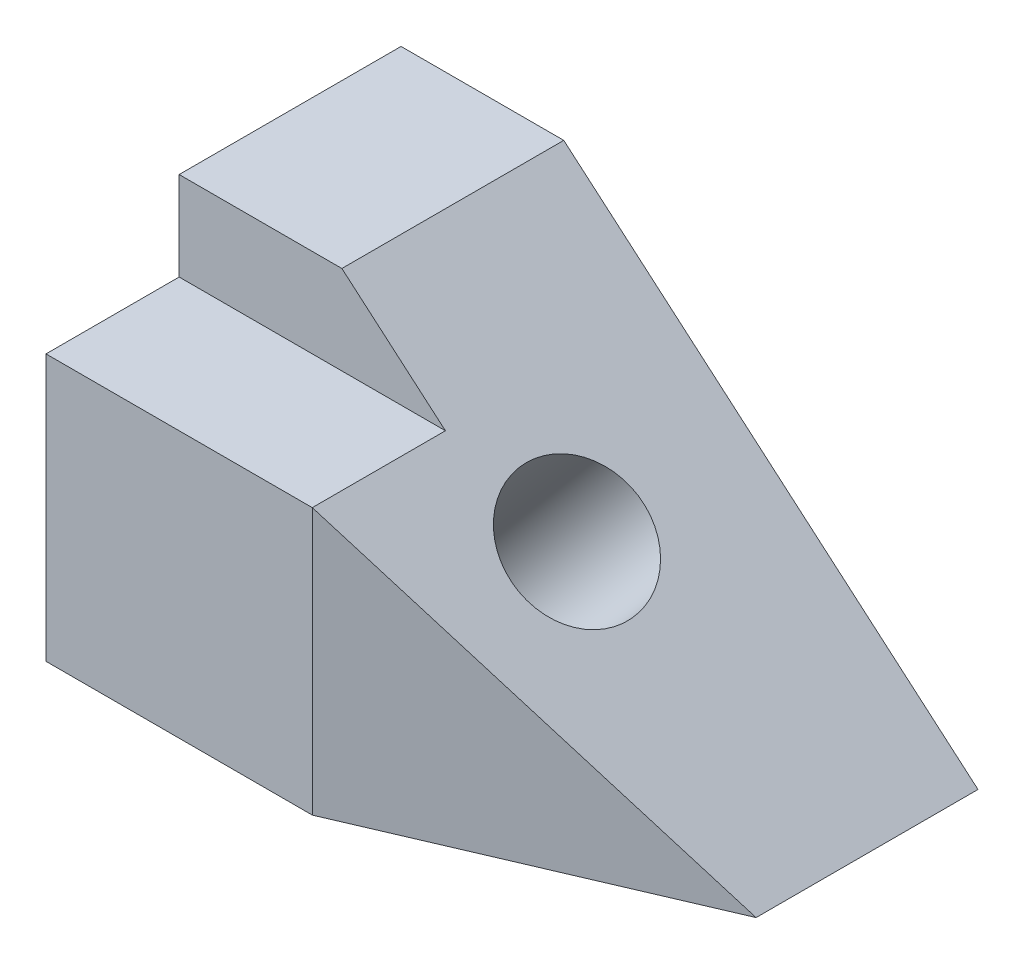
from build123d import *

# Parameters (mm, degrees)
BOSS_EXTRUDE1_DEPTH = 50
BOSS_EXTRUDE2_DEPTH = 30
SKETCH3_R           = 15
CUT_EXTRUDE1_DEPTH  = 30
CUT_EXTRUDE3_REACH  = 103.85
CUT_EXTRUDE4_REACH  = 132.508
SKETCH3_3_R         = 15


with BuildPart() as part:
    # Sketch1 → Boss-Extrude1 (new body)
    with BuildSketch(Plane.XY):
        Polygon((-27.961904762, 106.171428571), (-64.628571429, 106.171428571), (-64.628571429, 26.171428571), (65.371428571, 26.171428571), align=None)
    extrude(amount=-BOSS_EXTRUDE1_DEPTH)

    # Sketch1<4> → Boss-Extrude2 (add)
    with BuildSketch(Plane.XY):
        Polygon((-4.628571429, 86.171428571), (-64.628571429, 86.171428571), (-64.628571429, 26.171428571), (65.371428571, 26.171428571), align=None)
    extrude(amount=BOSS_EXTRUDE2_DEPTH)

    # Sketch3 → Cut-Extrude1 (cut)
    with BuildSketch(Plane(origin=(40.618487395, 47.388235294, 0), x_dir=(0.7592566023652969, -0.6507913734559682, 0), z_dir=(0.6507913734559682, 0.7592566023652969, 0))):
        with Locations((-33.725710627, 10)):
            Circle(SKETCH3_R)
    extrude(amount=-CUT_EXTRUDE1_DEPTH, mode=Mode.SUBTRACT)

    # Sketch4 → Cut-Extrude3 (cut, up to next)
    with BuildSketch(Plane(origin=(0, 86.171428571, 0), x_dir=(1, 0, 0), z_dir=(0, 1, 0)), mode=Mode.PRIVATE) as cut_extrude3_sk1:
        Polygon((65.371428571, -30), (-4.628571429, -30), (65.371428571, 0), align=None)
    cut_extrude3_tool1 = extrude(cut_extrude3_sk1.sketch, amount=-CUT_EXTRUDE3_REACH, mode=Mode.PRIVATE) & part.part
    add(cut_extrude3_tool1.solids().sort_by_distance((42.038095, 86.171429, 20))[0], mode=Mode.SUBTRACT)

    # Sketch3<3> → Cut-Extrude4 (cut, up to next)
    with BuildSketch(Plane(origin=(40.618487395, 47.388235294, 0), x_dir=(0.7592566023652969, -0.6507913734559682, 0), z_dir=(0.6507913734559682, 0.7592566023652969, 0)), mode=Mode.PRIVATE) as cut_extrude4_sk1:
        with Locations((-33.725710627, 10)):
            Circle(SKETCH3_3_R)
    cut_extrude4_tool1 = extrude(cut_extrude4_sk1.sketch, amount=-CUT_EXTRUDE4_REACH, mode=Mode.PRIVATE) & part.part
    add(cut_extrude4_tool1.solids().sort_by_distance((15.012019, 69.336637, -10))[0], mode=Mode.SUBTRACT)


solid = part.part
